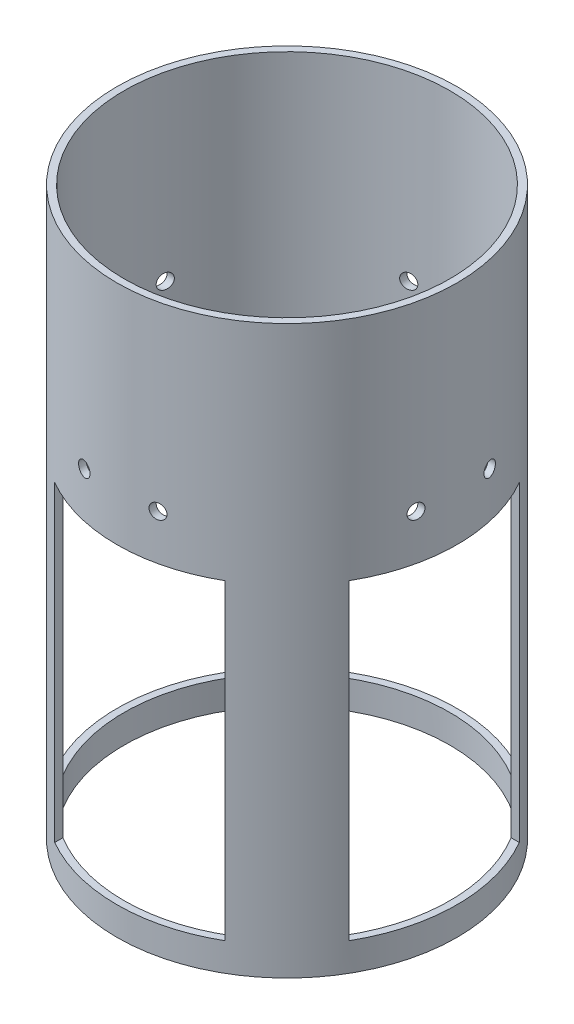
from build123d import *

# Parameters (mm, degrees)
SKETCH1_R           = 76.2
SKETCH1_R_2         = 73.025
BOSS_EXTRUDE1_DEPTH = 254
SKETCH6_W           = 76.2
SKETCH6_H           = 139.7
CUT_EXTRUDE6_DEPTH  = 20.574
CIRPATTERN9_COUNT   = 4
SKETCH7_R           = 3.302
CUT_EXTRUDE7_DEPTH  = 17.78
CIRPATTERN10_COUNT  = 4


with BuildPart() as part:
    # Sketch1 → Boss-Extrude1 (new body)
    with BuildSketch(Plane(origin=(0, 0, 0), x_dir=(1, 0, 0), z_dir=(0, 1, 0))):
        with Locations(Location((0, 0, 0), (0, 0, 270))):
            Circle(SKETCH1_R)
        with Locations(Location((0, 0, 0), (0, 0, 270))):
            Circle(SKETCH1_R_2, mode=Mode.SUBTRACT)
    extrude(amount=BOSS_EXTRUDE1_DEPTH)

    # Sketch6 → Cut-Extrude6 (cut)
    with BuildSketch(Plane(origin=(0, 0, -76.2), x_dir=(-1, 0, 0), z_dir=(0, 0, -1))):
        with Locations((0, 82.55)):
            Rectangle(SKETCH6_W, SKETCH6_H)
    cut_extrude6 = extrude(amount=-CUT_EXTRUDE6_DEPTH, mode=Mode.SUBTRACT)

    # CirPattern9: Cut-Extrude6 ×4 about axis
    cirpattern9_axis = Axis((0, 0, 0), (0, 1, 0))
    for i in range(1, CIRPATTERN9_COUNT):
        add(cut_extrude6.rotate(cirpattern9_axis, i * 360 / CIRPATTERN9_COUNT), mode=Mode.SUBTRACT)

    # Sketch7 → Cut-Extrude7 (cut)
    with BuildSketch(Plane(origin=(0, 0, -76.2), x_dir=(-1, 0, 0), z_dir=(0, 0, -1))):
        with Locations((-16.51, 172.72)):
            Circle(SKETCH7_R)
        with Locations((16.51, 172.72)):
            Circle(SKETCH7_R)
    cut_extrude7 = extrude(amount=-CUT_EXTRUDE7_DEPTH, mode=Mode.SUBTRACT)

    # CirPattern10: Cut-Extrude7 ×4 about axis
    cirpattern10_axis = Axis((0, 254, 0), (0, 1, 0))
    for i in range(1, CIRPATTERN10_COUNT):
        add(cut_extrude7.rotate(cirpattern10_axis, i * 360 / CIRPATTERN10_COUNT), mode=Mode.SUBTRACT)


solid = part.part
